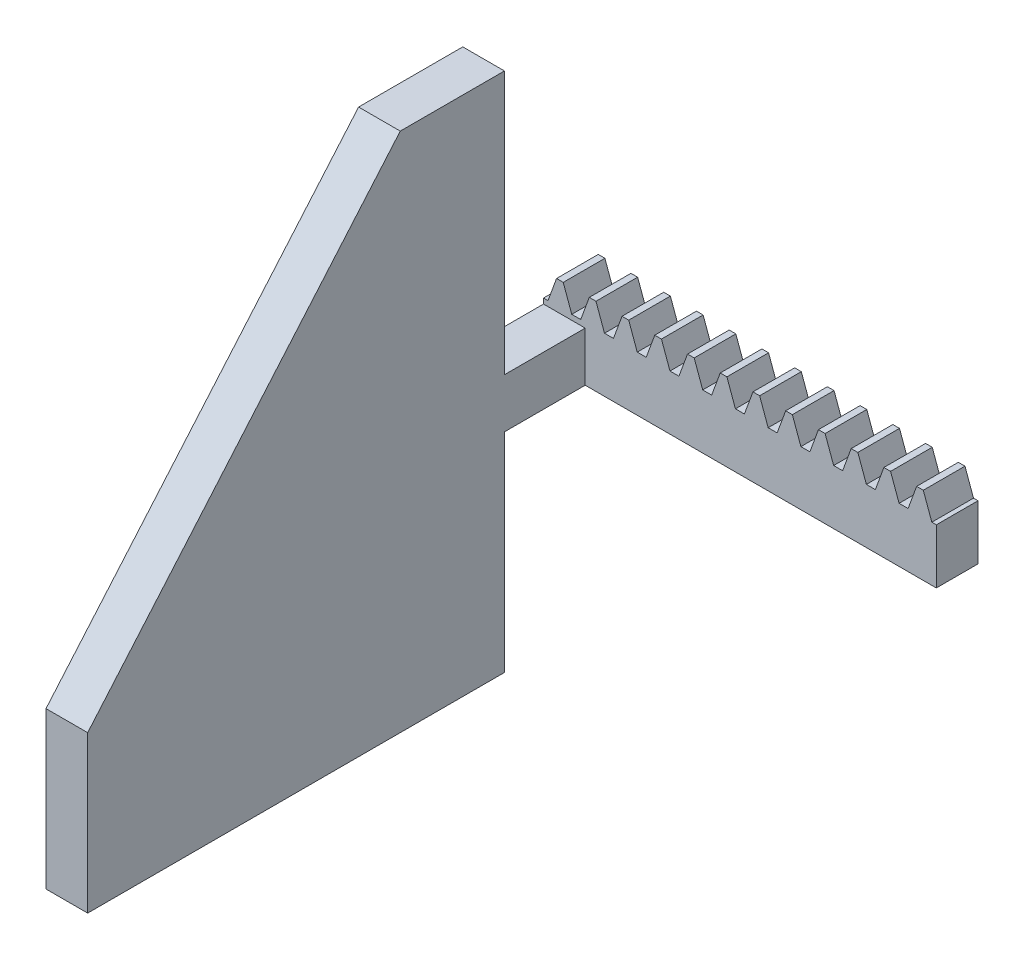
from build123d import *

# Parameters (mm, degrees)
BLANKSKE_W          = 120
BLANKSKE_H          = 16
BLANK_DEPTH         = 8
TOOTHCUTSIM_DEPTH   = 122.326007105
TEETHCUTS_COUNT     = 20
TEETHCUTS_PITCH     = 6.2831853
SKETCH1_W           = 8
SKETCH1_H           = 1
CUT_EXTRUDE1_DEPTH  = 122.326007105
BOSS_EXTRUDE2_DEPTH = 8
CUT_EXTRUDE2_DEPTH  = 170.803562978


with BuildPart() as part:
    # BlankSke → Blank (new body)
    with BuildSketch(Plane.XY):
        with Locations((60, 8)):
            Rectangle(BLANKSKE_W, BLANKSKE_H)
    extrude(amount=-BLANK_DEPTH)

    # TooCutSkeSim → ToothCutSim (cut, through all)
    with BuildSketch(Plane.XY):
        Polygon((0.861870739, 11.5), (-0.861870739, 11.5), (-2.508981637, 16.0254), (2.508981637, 16.0254), align=None)
    toothcutsim = extrude(amount=-TOOTHCUTSIM_DEPTH, mode=Mode.SUBTRACT)

    # TeethCuts: ToothCutSim ×20
    with Locations(*[(i * TEETHCUTS_PITCH, 0, 0) for i in range(1, TEETHCUTS_COUNT)]):
        add(toothcutsim, mode=Mode.SUBTRACT)

    # Sketch1 → Cut-Extrude1 (cut, through all)
    with BuildSketch(Plane(origin=(120, 0, 0), x_dir=(0, 0, -1), z_dir=(1, 0, 0))):
        with Locations((4, 0.5)):
            Rectangle(SKETCH1_W, SKETCH1_H)
    extrude(amount=-CUT_EXTRUDE1_DEPTH, mode=Mode.SUBTRACT)

    # Sketch3 → Boss-Extrude2 (add)
    with BuildSketch(Plane.ZY):
        Polygon((0, 1), (15.5, 1), (15.5, -39), (95.5, -39), (95.5, -9), (35.5, 61), (15.5, 61), (15.5, 10.5), (0, 10.5), align=None)
    extrude(amount=-BOSS_EXTRUDE2_DEPTH)

    # Sketch4 → Cut-Extrude2 (cut, through all)
    with BuildSketch(Plane(origin=(0, 0, -8), x_dir=(-1, 0, 0), z_dir=(0, 0, -1))):
        Polygon((-120, 11.5), (-118.518649961, 11.5), (-116.880783906, 16), (-115.597072194, 16), (-113.959206139, 11.5), (-113.218706139, 11.5), (-112.235464661, 11.5), (-110.597598606, 16), (-109.313886894, 16), (-107.676020839, 11.5), (-105.952279361, 11.5), (-104.314413306, 16), (-103.030701594, 16), (-101.392835539, 11.5), (-99.669094061, 11.5), (-98.031228006, 16), (-96.747516294, 16), (-95.109650239, 11.5), (-93.385908761, 11.5), (-91.748042706, 16), (-90.464330994, 16), (-88.826464939, 11.5), (-87.102723461, 11.5), (-85.464857406, 16), (-84.181145694, 16), (-82.543279639, 11.5), (-80.819538161, 11.5), (-79.181672106, 16), (-77.897960394, 16), (-76.260094339, 11.5), (-75.3982236, 11.5), (-75.3982236, 1), (-76.260094339, 1), (-101.392835539, 1), (-113.218706139, 1), (-120, 1), align=None)
    extrude(amount=-CUT_EXTRUDE2_DEPTH, mode=Mode.SUBTRACT)


solid = part.part
